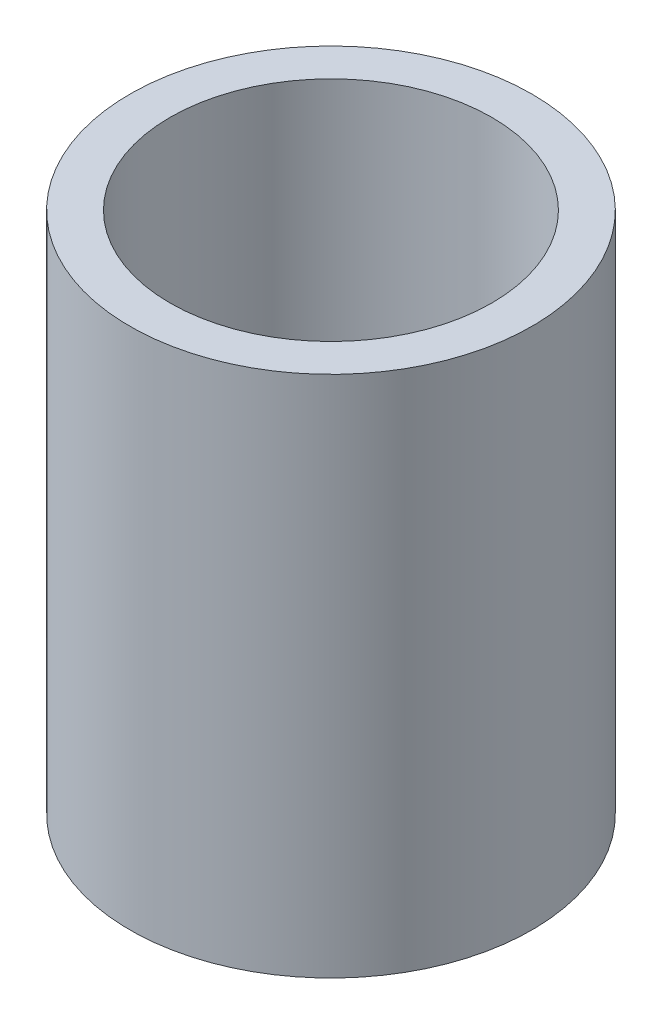
from build123d import *

# Parameters (mm, degrees)
SKETCH1_R           = 5
SKETCH1_R_2         = 4
BOSS_EXTRUDE1_DEPTH = 13


with BuildPart() as part:
    # Sketch1 → Boss-Extrude1 (new body)
    with BuildSketch(Plane(origin=(0, 0, 0), x_dir=(1, 0, 0), z_dir=(0, 1, 0))):
        with Locations(Location((0, 0, 0), (0, 0, 90))):
            Circle(SKETCH1_R)
        with Locations(Location((0, 0, 0), (0, 0, 90))):
            Circle(SKETCH1_R_2, mode=Mode.SUBTRACT)
    extrude(amount=BOSS_EXTRUDE1_DEPTH)


solid = part.part
